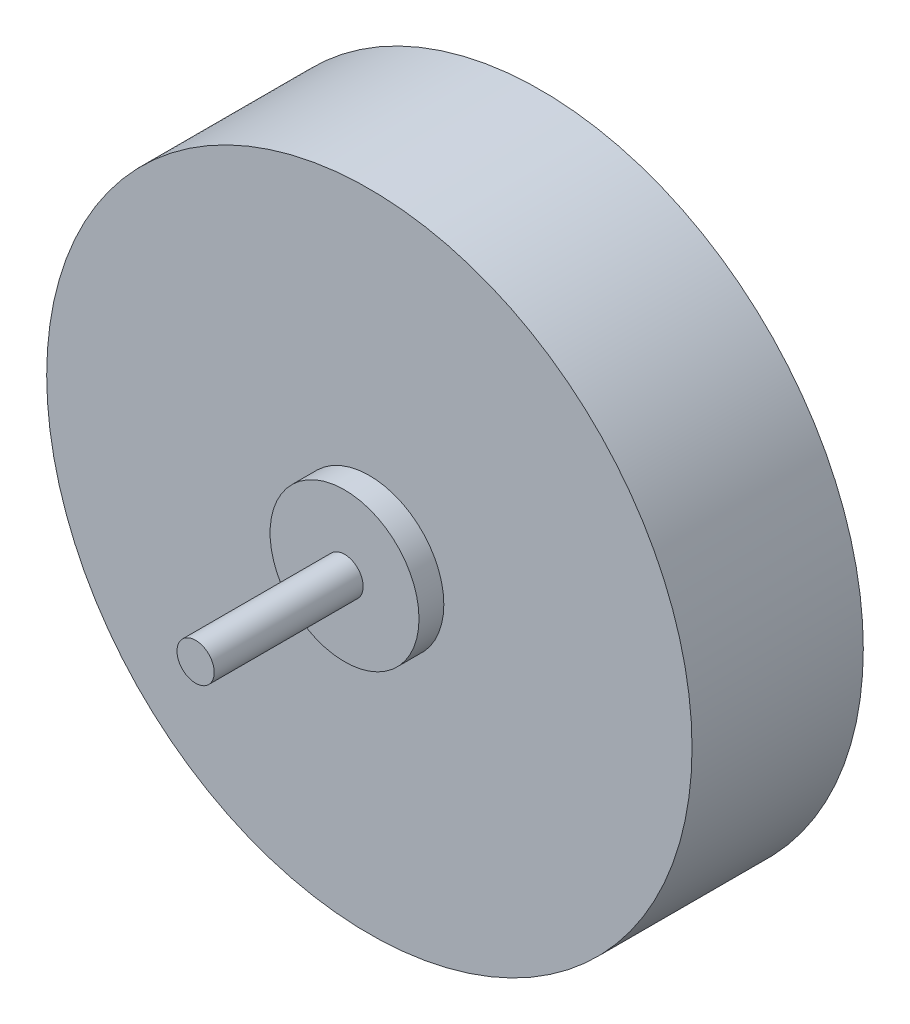
from build123d import *

# Parameters (mm, degrees)
ESQUISSE1_R        = 13
BOSS_EXTRU_1_DEPTH = 6.9
ESQUISSE2_R        = 3
BOSS_EXTRU_2_DEPTH = 1
ESQUISSE3_R        = 0.75
BOSS_EXTRU_3_DEPTH = 6
BOSS_EXTRU_4_START = 2.3
ESQUISSE4_R        = 3
BOSS_EXTRU_4_DEPTH = 2.3


with BuildPart() as part:
    # Esquisse1 → Boss.-Extru.1 (new body)
    with BuildSketch(Plane.XY):
        with Locations(Location((0, 0, 0), (0, 0, 180))):
            Circle(ESQUISSE1_R)
    extrude(amount=BOSS_EXTRU_1_DEPTH)

    # Esquisse2 → Boss.-Extru.2 (add)
    with BuildSketch(Plane.XY.offset(6.9)):
        Circle(ESQUISSE2_R)
    extrude(amount=BOSS_EXTRU_2_DEPTH)

    # Esquisse3 → Boss.-Extru.3 (add)
    with BuildSketch(Plane.XY.offset(7.9)):
        Circle(ESQUISSE3_R)
    extrude(amount=BOSS_EXTRU_3_DEPTH)

    # Esquisse4 → Boss.-Extru.4 (add)
    with BuildSketch(Plane(origin=(0, 0, 0), x_dir=(-1, 0, 0), z_dir=(0, 0, -1)).offset(BOSS_EXTRU_4_START)):
        with Locations(Location((0, 0, 0), (0, 0, 180))):
            Circle(ESQUISSE4_R)
    extrude(amount=-BOSS_EXTRU_4_DEPTH)


solid = part.part
